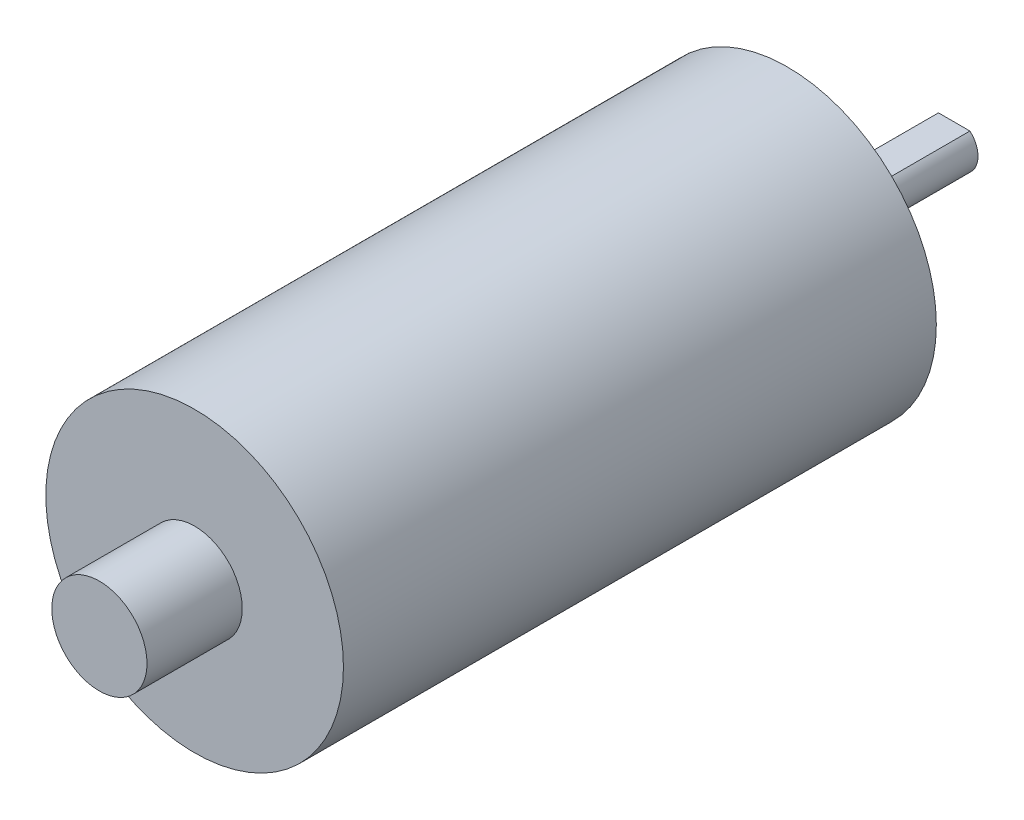
from build123d import *

# Parameters (mm, degrees)
SKETCH_1_R          = 12.5
EXTRUDE_1_DEPTH     = 49.8
SKETCH_2_R          = 3.5
EXTRUDE_2_DEPTH     = 2.5
SKETCH_3_R          = 2
EXTRUDE_3_DEPTH     = 11.5
CUT_EXTRUDE_START   = -9
CUT_EXTRUDE_1_DEPTH = 9
SKETCH_5_R          = 1.5
CUT_EXTRUDE_2_DEPTH = 3
SKETCH_6_R          = 4
EXTRUDE_4_DEPTH     = 8


with BuildPart() as part:
    # 草图1 → 凸台-拉伸1 (new body)
    with BuildSketch(Plane.XY):
        Circle(SKETCH_1_R)
    extrude(amount=EXTRUDE_1_DEPTH)

    # 草图2 → 凸台-拉伸2 (add)
    with BuildSketch(Plane(origin=(0, 0, 0), x_dir=(-1, 0, 0), z_dir=(0, 0, -1))):
        Circle(SKETCH_2_R)
    extrude(amount=EXTRUDE_2_DEPTH)

    # 草图3 → 凸台-拉伸3 (add)
    with BuildSketch(Plane(origin=(0, 0, -2.5), x_dir=(-1, 0, 0), z_dir=(0, 0, -1))):
        Circle(SKETCH_3_R)
    extrude(amount=EXTRUDE_3_DEPTH)

    # 草图4 → 切除-拉伸1 (cut)
    with BuildSketch(Plane(origin=(0, 0, -14), x_dir=(-1, 0, 0), z_dir=(0, 0, -1)).offset(CUT_EXTRUDE_START)):
        with BuildLine():
            Line((-1.322875656, 1.5), (0, 1.5))
            Line((0, 1.5), (1.322875656, 1.5))
            ThreePointArc((1.322875656, 1.5), (0, 2), (-1.322875656, 1.5))
        make_face()
    extrude(amount=CUT_EXTRUDE_1_DEPTH, mode=Mode.SUBTRACT)

    # 草图5 → 切除-拉伸2 (cut)
    with BuildSketch(Plane(origin=(0, 0, 0), x_dir=(-1, 0, 0), z_dir=(0, 0, -1))):
        with Locations((8.5, 0)):
            Circle(SKETCH_5_R)
        with Locations(Location((-8.5, 0, 0), (0, 0, 180))):
            Circle(SKETCH_5_R)
    extrude(amount=-CUT_EXTRUDE_2_DEPTH, mode=Mode.SUBTRACT)

    # 草图6 → 凸台-拉伸4 (add)
    with BuildSketch(Plane.XY.offset(49.8)):
        Circle(SKETCH_6_R)
    extrude(amount=EXTRUDE_4_DEPTH)


solid = part.part
